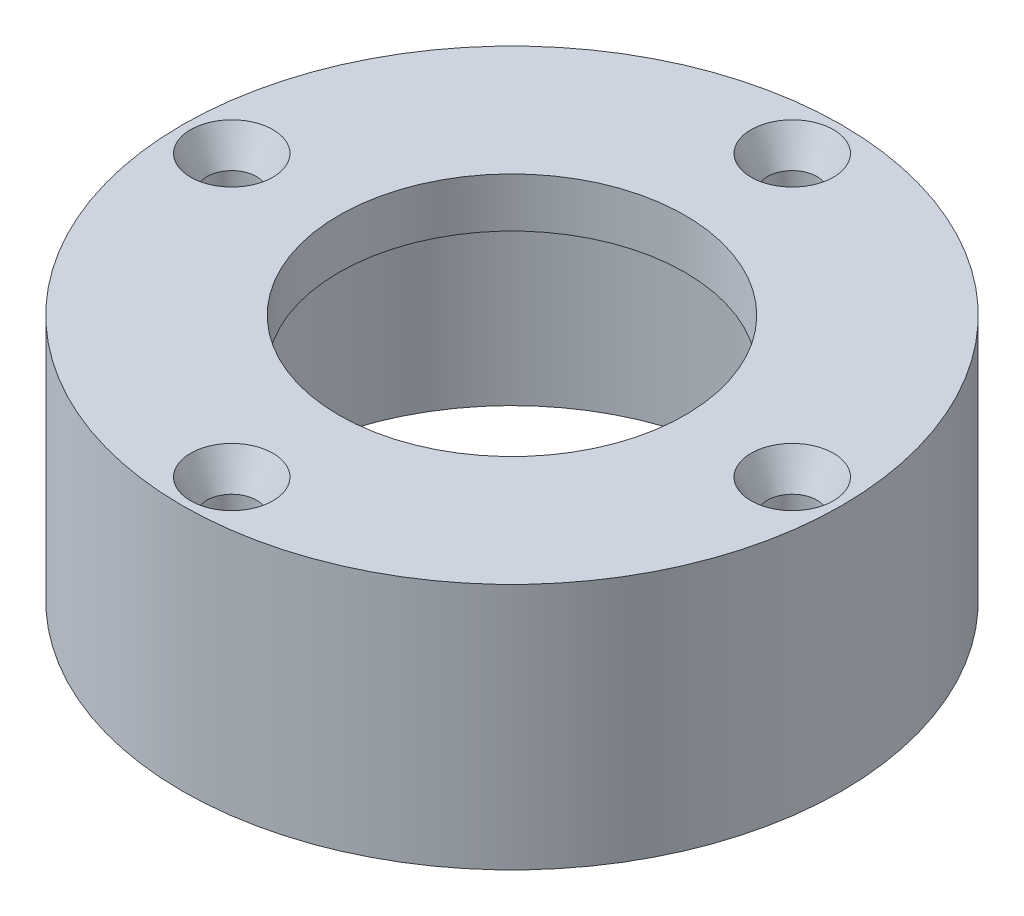
from build123d import *

# Parameters (mm, degrees)
SKETCH1_R                    = 20
BOSS_EXTRUDE1_DEPTH          = 15
SKETCH4_R                    = 14.5
CUT_EXTRUDE3_DEPTH           = 12
SKETCH5_R                    = 10.5
CUT_EXTRUDE4_DEPTH           = 12
SKETCH6_R                    = 1.5
CUT_EXTRUDE5_DEPTH           = 33.015621187
SKETCH7_R                    = 2.5
CUT_EXTRUDE7_DEPTH           = 2
CUT_EXTRUDE7_DRAFT           = -27
CUT_EXTRUDE7_PROFILE_2_DEPTH = 2
CUT_EXTRUDE7_PROFILE_2_DRAFT = -27
CUT_EXTRUDE7_PROFILE_3_DEPTH = 2
CUT_EXTRUDE7_PROFILE_3_DRAFT = -27
CUT_EXTRUDE7_PROFILE_4_DEPTH = 2
CUT_EXTRUDE7_PROFILE_4_DRAFT = -27


with BuildPart() as part:
    # Sketch1 → Boss-Extrude1 (new body)
    with BuildSketch(Plane(origin=(0, 0, 0), x_dir=(1, 0, 0), z_dir=(0, 1, 0))):
        with Locations(Location((0, 0, 0), (0, 0, 270))):
            Circle(SKETCH1_R)
    extrude(amount=BOSS_EXTRUDE1_DEPTH)

    # Sketch4 → Cut-Extrude3 (cut)
    with BuildSketch(Plane.XZ):
        with Locations(Location((0, 0, 0), (0, 0, 270))):
            Circle(SKETCH4_R)
    extrude(amount=-CUT_EXTRUDE3_DEPTH, mode=Mode.SUBTRACT)

    # Sketch5 → Cut-Extrude4 (cut)
    with BuildSketch(Plane(origin=(0, 15, 0), x_dir=(1, 0, 0), z_dir=(0, 1, 0))):
        with Locations(Location((0, 0, 0), (0, 0, 270))):
            Circle(SKETCH5_R)
    extrude(amount=-CUT_EXTRUDE4_DEPTH, mode=Mode.SUBTRACT)

    # Sketch6 → Cut-Extrude5 (cut, through all)
    with BuildSketch(Plane(origin=(0, 15, 0), x_dir=(1, 0, 0), z_dir=(0, 1, 0))):
        with Locations(Location((0, 17, 0), (0, 0, 270))):
            Circle(SKETCH6_R)
        with Locations(Location((17, 0, 0), (0, 0, 270))):
            Circle(SKETCH6_R)
        with Locations(Location((0, -17, 0), (0, 0, 270))):
            Circle(SKETCH6_R)
        with Locations(Location((-17, 0, 0), (0, 0, 270))):
            Circle(SKETCH6_R)
    extrude(amount=-CUT_EXTRUDE5_DEPTH, mode=Mode.SUBTRACT)


with BuildPart() as cut_extrude7_tool:
    # Sketch7 → Cut-Extrude7 (with draft: the straight prism first)
    with BuildSketch(Plane(origin=(0, 15, 0), x_dir=(1, 0, 0), z_dir=(0, 1, 0))):
        with Locations((0, 17)):
            Circle(SKETCH7_R)
    extrude(amount=-CUT_EXTRUDE7_DEPTH)
    # Cut-Extrude7: the draft: its side faces are tilted about the plane it starts from
    cut_extrude7_sides = [cut_extrude7_tool.faces().sort_by_distance(p)[0] for p in [
        (-2.5, 14, -17),
    ]]
    draft(cut_extrude7_sides, Plane(origin=(0, 15, 0), x_dir=(1, 0, 0), z_dir=(0, 1, 0)), CUT_EXTRUDE7_DRAFT)


with BuildPart() as part_1:
    add(part.part)

    # Cut-Extrude7: cut by cut_extrude7_tool
    add(cut_extrude7_tool.part, mode=Mode.SUBTRACT)


with BuildPart() as cut_extrude7_profile_2_tool:
    # Sketch7 → Cut-Extrude7 profile 2 (with draft: the straight prism first)
    with BuildSketch(Plane(origin=(0, 15, 0), x_dir=(1, 0, 0), z_dir=(0, 1, 0))):
        with Locations((17, 0)):
            Circle(SKETCH7_R)
    extrude(amount=-CUT_EXTRUDE7_PROFILE_2_DEPTH)
    # Cut-Extrude7 profile 2: the draft: its side faces are tilted about the plane it starts from
    cut_extrude7_profile_2_sides = [cut_extrude7_profile_2_tool.faces().sort_by_distance(p)[0] for p in [
        (14.5, 14, 0),
    ]]
    draft(cut_extrude7_profile_2_sides, Plane(origin=(0, 15, 0), x_dir=(1, 0, 0), z_dir=(0, 1, 0)), CUT_EXTRUDE7_PROFILE_2_DRAFT)


with BuildPart() as part_2:
    add(part_1.part)

    # Cut-Extrude7 profile 2: cut by cut_extrude7_profile_2_tool
    add(cut_extrude7_profile_2_tool.part, mode=Mode.SUBTRACT)


with BuildPart() as cut_extrude7_profile_3_tool:
    # Sketch7 → Cut-Extrude7 profile 3 (with draft: the straight prism first)
    with BuildSketch(Plane(origin=(0, 15, 0), x_dir=(1, 0, 0), z_dir=(0, 1, 0))):
        with Locations((0, -17)):
            Circle(SKETCH7_R)
    extrude(amount=-CUT_EXTRUDE7_PROFILE_3_DEPTH)
    # Cut-Extrude7 profile 3: the draft: its side faces are tilted about the plane it starts from
    cut_extrude7_profile_3_sides = [cut_extrude7_profile_3_tool.faces().sort_by_distance(p)[0] for p in [
        (-2.5, 14, 17),
    ]]
    draft(cut_extrude7_profile_3_sides, Plane(origin=(0, 15, 0), x_dir=(1, 0, 0), z_dir=(0, 1, 0)), CUT_EXTRUDE7_PROFILE_3_DRAFT)


with BuildPart() as part_3:
    add(part_2.part)

    # Cut-Extrude7 profile 3: cut by cut_extrude7_profile_3_tool
    add(cut_extrude7_profile_3_tool.part, mode=Mode.SUBTRACT)


with BuildPart() as cut_extrude7_profile_4_tool:
    # Sketch7 → Cut-Extrude7 profile 4 (with draft: the straight prism first)
    with BuildSketch(Plane(origin=(0, 15, 0), x_dir=(1, 0, 0), z_dir=(0, 1, 0))):
        with Locations((-17, 0)):
            Circle(SKETCH7_R)
    extrude(amount=-CUT_EXTRUDE7_PROFILE_4_DEPTH)
    # Cut-Extrude7 profile 4: the draft: its side faces are tilted about the plane it starts from
    cut_extrude7_profile_4_sides = [cut_extrude7_profile_4_tool.faces().sort_by_distance(p)[0] for p in [
        (-19.5, 14, 0),
    ]]
    draft(cut_extrude7_profile_4_sides, Plane(origin=(0, 15, 0), x_dir=(1, 0, 0), z_dir=(0, 1, 0)), CUT_EXTRUDE7_PROFILE_4_DRAFT)


with BuildPart() as part_4:
    add(part_3.part)

    # Cut-Extrude7 profile 4: cut by cut_extrude7_profile_4_tool
    add(cut_extrude7_profile_4_tool.part, mode=Mode.SUBTRACT)


solid = part_4.part
